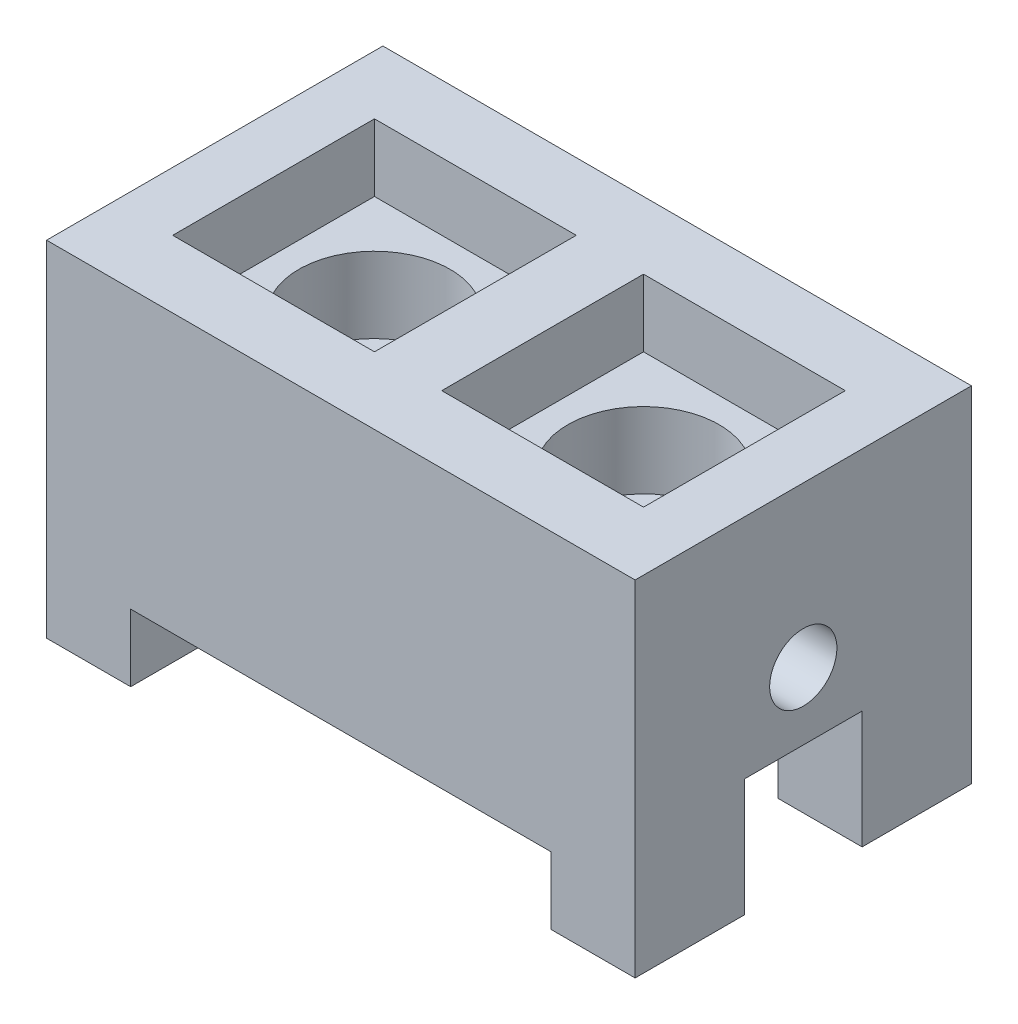
from build123d import *

# Parameters (mm, degrees)
BOSS_EXTRUDE3_DEPTH = 40
SKETCH7_W           = 14
SKETCH7_H           = 14
CUT_EXTRUDE3_DEPTH  = 108
SKETCH8_R           = 4
CUT_EXTRUDE4_DEPTH  = 108
SKETCH9_W           = 24
SKETCH9_H           = 24
CUT_EXTRUDE5_DEPTH  = 8
SKETCH10_R          = 9
CUT_EXTRUDE6_DEPTH  = 9
SKETCH11_R          = 9
CUT_EXTRUDE7_DEPTH  = 9


with BuildPart() as part:
    # Sketch1 → Boss-Extrude3 (new body)
    with BuildSketch(Plane.XY):
        Polygon((10, 0), (10, 8), (60, 8), (60, 0), (70, 0), (70, 41), (0, 41), (0, 0), align=None)
    extrude(amount=BOSS_EXTRUDE3_DEPTH)

    # Sketch7 → Cut-Extrude3 (cut)
    with BuildSketch(Plane(origin=(70, 0, 0), x_dir=(0, 0, -1), z_dir=(1, 0, 0))):
        with Locations((-20, 7)):
            Rectangle(SKETCH7_W, SKETCH7_H)
    extrude(amount=-CUT_EXTRUDE3_DEPTH, mode=Mode.SUBTRACT)

    # Sketch8 → Cut-Extrude4 (cut)
    with BuildSketch(Plane(origin=(70, 0, 0), x_dir=(0, 0, -1), z_dir=(1, 0, 0))):
        with Locations(Location((-20, 22, 0), (0, 0, 90))):
            Circle(SKETCH8_R)
    extrude(amount=-CUT_EXTRUDE4_DEPTH, mode=Mode.SUBTRACT)

    # Sketch9 → Cut-Extrude5 (cut)
    with BuildSketch(Plane(origin=(0, 41, 0), x_dir=(1, 0, 0), z_dir=(0, 1, 0))):
        with Locations((19, -20)):
            Rectangle(SKETCH9_W, SKETCH9_H)
        with Locations((51, -20)):
            Rectangle(SKETCH9_W, SKETCH9_H)
    extrude(amount=-CUT_EXTRUDE5_DEPTH, mode=Mode.SUBTRACT)

    # Sketch10 → Cut-Extrude6 (cut)
    with BuildSketch(Plane(origin=(0, 33, 0), x_dir=(1, 0, 0), z_dir=(0, 1, 0))):
        with Locations(Location((19, -20, 0), (0, 0, 270))):
            Circle(SKETCH10_R)
    extrude(amount=-CUT_EXTRUDE6_DEPTH, mode=Mode.SUBTRACT)

    # Sketch11 → Cut-Extrude7 (cut)
    with BuildSketch(Plane(origin=(0, 33, 0), x_dir=(1, 0, 0), z_dir=(0, 1, 0))):
        with Locations(Location((51, -20, 0), (0, 0, 270))):
            Circle(SKETCH11_R)
    extrude(amount=-CUT_EXTRUDE7_DEPTH, mode=Mode.SUBTRACT)


solid = part.part
